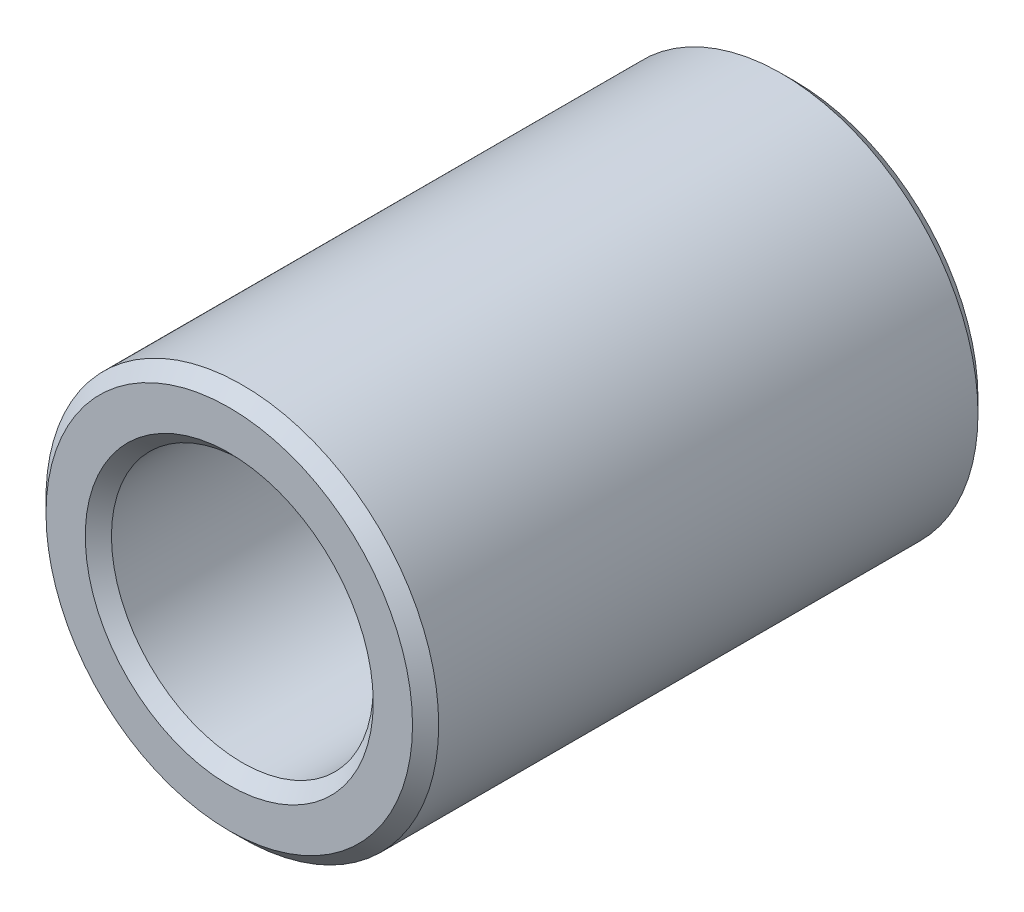
from build123d import *

# Parameters (mm, degrees)
SKIZZE1_R                       = 1.5
SKIZZE1_R_2                     = 1
AUFSATZ_LINEAR_AUSTRAGEN1_DEPTH = 4.32
FASE1_SIZE                      = 0.1


with BuildPart() as part:
    # Skizze1 → Aufsatz-Linear austragen1 (new body)
    with BuildSketch(Plane.XY):
        Circle(SKIZZE1_R)
        Circle(SKIZZE1_R_2, mode=Mode.SUBTRACT)
    extrude(amount=AUFSATZ_LINEAR_AUSTRAGEN1_DEPTH)

    # Fase1
    fase1_edges = [part.edges().sort_by_distance(p)[0] for p in [
        (-1.5, 0, 0),
        (-1.5, 0, 4.32),
        (-1, 0, 0),
        (-1, 0, 4.32),
    ]]
    chamfer(fase1_edges, length=FASE1_SIZE)


solid = part.part
